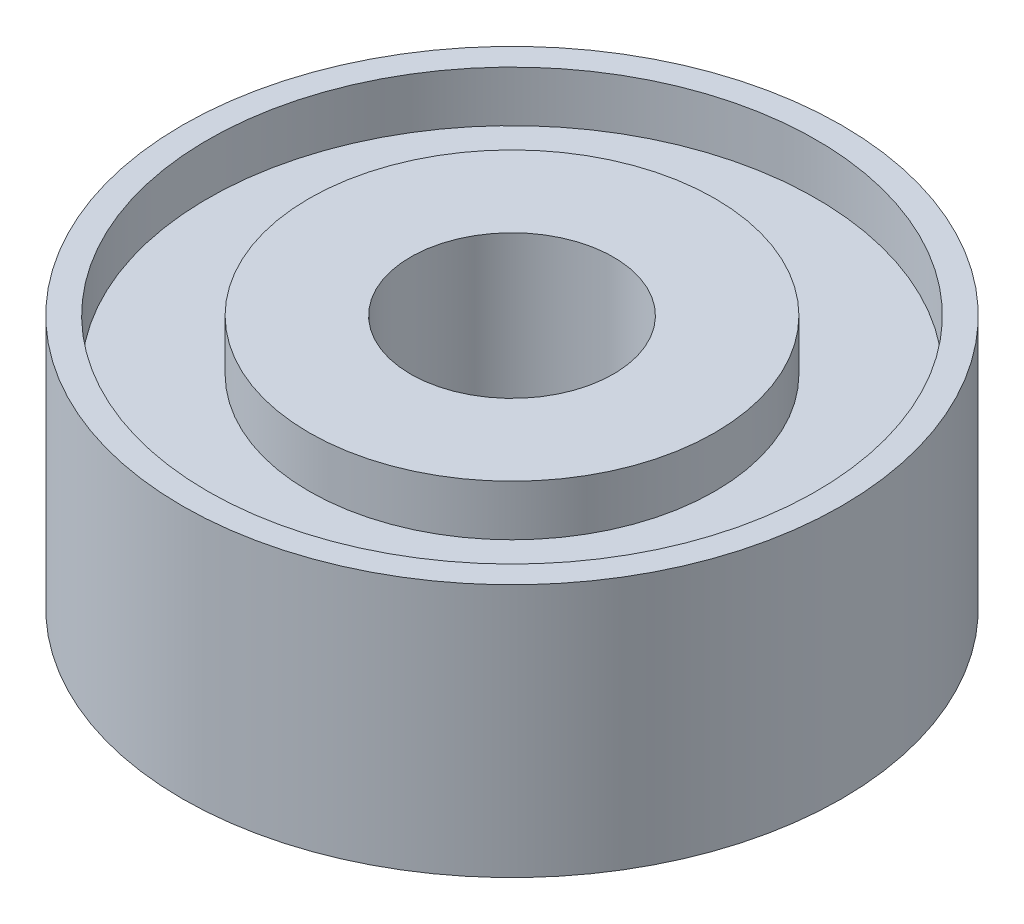
from build123d import *

# Parameters (mm, degrees)
SKETCH2_R           = 6.5
SKETCH2_R_2         = 2
BOSS_EXTRUDE1_DEPTH = 5
SKETCH3_R           = 6
SKETCH3_R_2         = 4
CUT_EXTRUDE1_DEPTH  = 1
CUT_EXTRUDE2_START  = -1
SKETCH4_R           = 6
SKETCH4_R_2         = 4
CUT_EXTRUDE2_DEPTH  = 1


with BuildPart() as part:
    # Sketch2 → Boss-Extrude1 (new body)
    with BuildSketch(Plane(origin=(0, 0, 0), x_dir=(1, 0, 0), z_dir=(0, 1, 0))):
        with Locations(Location((0, 0, 0), (0, 0, 270))):
            Circle(SKETCH2_R)
        with Locations(Location((0, 0, 0), (0, 0, 270))):
            Circle(SKETCH2_R_2, mode=Mode.SUBTRACT)
    extrude(amount=BOSS_EXTRUDE1_DEPTH)

    # Sketch3 → Cut-Extrude1 (cut)
    with BuildSketch(Plane(origin=(0, 5, 0), x_dir=(1, 0, 0), z_dir=(0, 1, 0))):
        with Locations(Location((0, 0, 0), (0, 0, 270))):
            Circle(SKETCH3_R)
        with Locations(Location((0, 0, 0), (0, 0, 270))):
            Circle(SKETCH3_R_2, mode=Mode.SUBTRACT)
    extrude(amount=-CUT_EXTRUDE1_DEPTH, mode=Mode.SUBTRACT)

    # Sketch4 → Cut-Extrude2 (cut)
    with BuildSketch(Plane.XZ.offset(CUT_EXTRUDE2_START)):
        with Locations(Location((0, 0, 0), (0, 0, 90))):
            Circle(SKETCH4_R)
        with Locations(Location((0, 0, 0), (0, 0, 90))):
            Circle(SKETCH4_R_2, mode=Mode.SUBTRACT)
    extrude(amount=CUT_EXTRUDE2_DEPTH, mode=Mode.SUBTRACT)


solid = part.part
